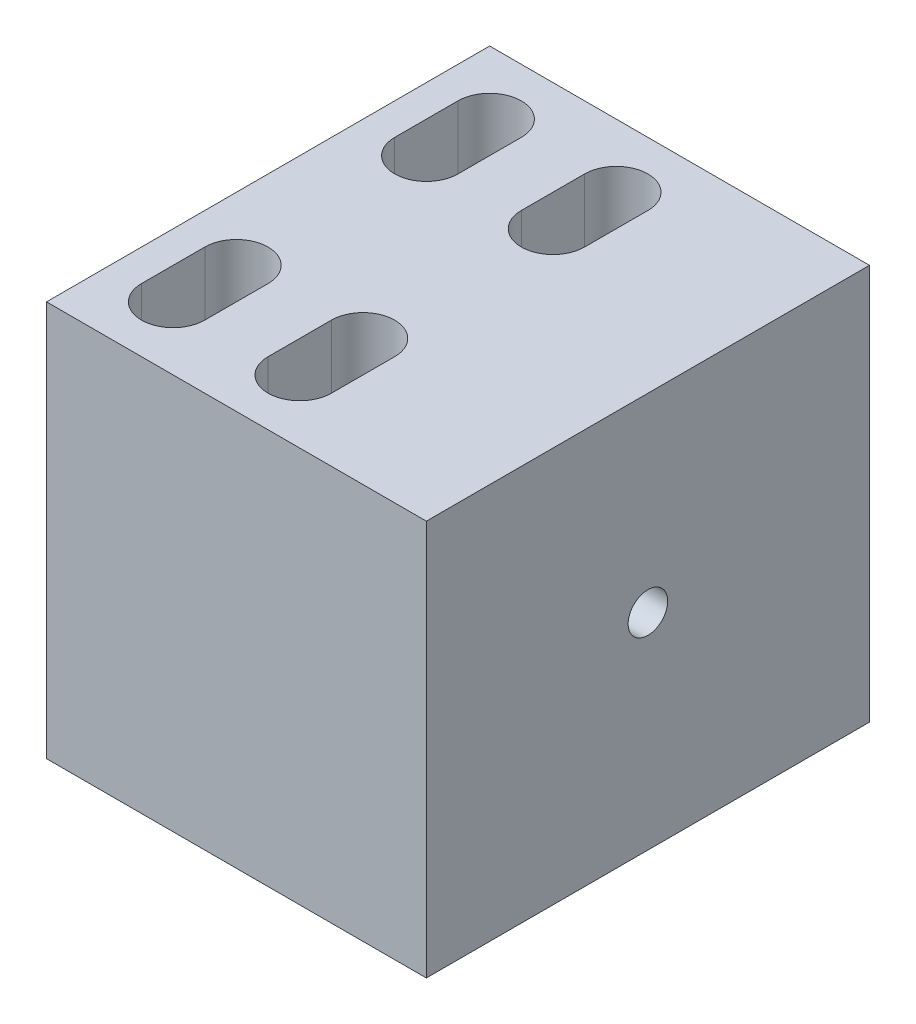
from build123d import *

# Parameters (mm, degrees)
SKETCH1_W           = 24
SKETCH1_H           = 28
BOSS_EXTRUDE1_DEPTH = 25
SKETCH2_R           = 1.25
CUT_EXTRUDE1_DEPTH  = 45.55333882


with BuildPart() as part:
    # Sketch1 → Boss-Extrude1 (new body)
    with BuildSketch(Plane(origin=(0, 0, 0), x_dir=(1, 0, 0), z_dir=(0, 1, 0))):
        with Locations((12, 14)):
            Rectangle(SKETCH1_W, SKETCH1_H)
        with BuildLine():
            Line((2, 4), (2, 8))
            ThreePointArc((2, 8), (4, 10), (6, 8))
            Line((6, 8), (6, 4))
            ThreePointArc((6, 4), (4, 2), (2, 4))
        make_face(mode=Mode.SUBTRACT)
        with BuildLine():
            Line((10, 4), (10, 8))
            ThreePointArc((10, 8), (12, 10), (14, 8))
            Line((14, 8), (14, 4))
            ThreePointArc((14, 4), (12, 2), (10, 4))
        make_face(mode=Mode.SUBTRACT)
        with BuildLine():
            Line((10, 20), (10, 24))
            ThreePointArc((10, 24), (12, 26), (14, 24))
            Line((14, 24), (14, 20))
            ThreePointArc((14, 20), (12, 18), (10, 20))
        make_face(mode=Mode.SUBTRACT)
        with BuildLine():
            Line((2, 20), (2, 24))
            ThreePointArc((2, 24), (4, 26), (6, 24))
            Line((6, 24), (6, 20))
            ThreePointArc((6, 20), (4, 18), (2, 20))
        make_face(mode=Mode.SUBTRACT)
    extrude(amount=BOSS_EXTRUDE1_DEPTH)

    # Sketch2 → Cut-Extrude1 (cut, through all)
    with BuildSketch(Plane(origin=(24, 0, 0), x_dir=(0, 0, -1), z_dir=(1, 0, 0))):
        with Locations((14, 13)):
            Circle(SKETCH2_R)
    extrude(amount=-CUT_EXTRUDE1_DEPTH, mode=Mode.SUBTRACT)


solid = part.part
